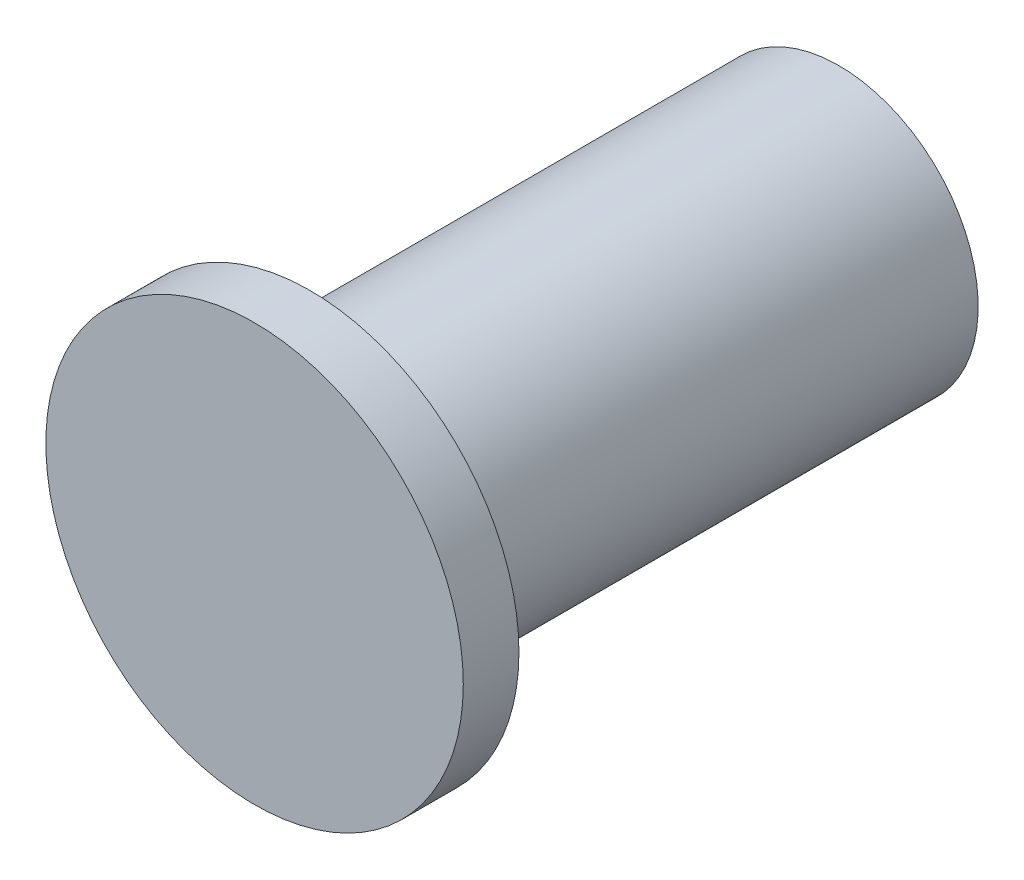
from build123d import *

# Parameters (mm, degrees)
ESQUISSE1_R        = 5
BOSS_EXTRU_1_DEPTH = 21
ESQUISSE2_R        = 7.5
BOSS_EXTRU_2_DEPTH = 2


with BuildPart() as part:
    # Esquisse1 → Boss.-Extru.1 (new body)
    with BuildSketch(Plane.XY):
        with Locations(Location((-10.375635214, 9.431547538, 0), (0, 0, 180))):
            Circle(ESQUISSE1_R)
    extrude(amount=BOSS_EXTRU_1_DEPTH)

    # Esquisse2 → Boss.-Extru.2 (add)
    with BuildSketch(Plane.XY.offset(21)):
        with Locations((-10.375635214, 9.431547538)):
            Circle(ESQUISSE2_R)
    extrude(amount=-BOSS_EXTRU_2_DEPTH)


solid = part.part
